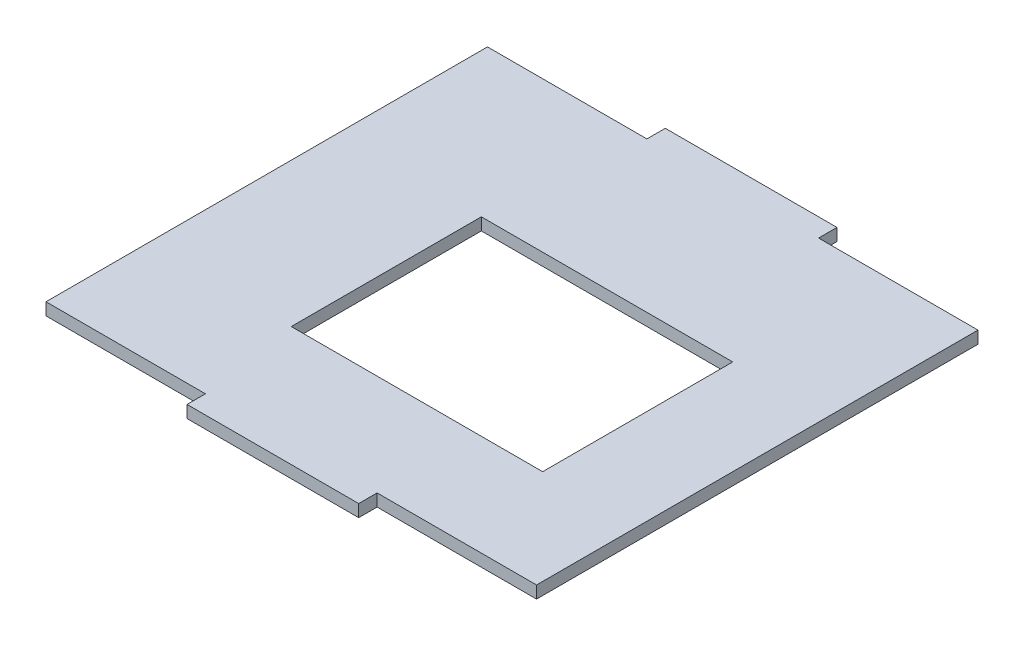
from build123d import *

# Parameters (mm, degrees)
SKETCH_1_W         = 43
SKETCH_1_H         = 39
TOP_DEPTH          = 1
DHT22_WINDOW_REACH = 31.043
SKETCH_2_W         = 20.5
SKETCH_2_H         = 15.5
EAR_REACH          = 31.043


with BuildPart() as part:
    # 스케치1 → Top (new body)
    with BuildSketch(Plane(origin=(0, 0, 0), x_dir=(1, 0, 0), z_dir=(0, 1, 0))):
        Rectangle(SKETCH_1_W, SKETCH_1_H)
    extrude(amount=TOP_DEPTH)

    # 스케치2 → DHT22_window (cut, up to next)
    with BuildSketch(Plane(origin=(0, 1, 0), x_dir=(1, 0, 0), z_dir=(0, 1, 0)), mode=Mode.PRIVATE) as dht22_window_sk1:
        with Locations((2, -2)):
            Rectangle(SKETCH_2_W, SKETCH_2_H)
    dht22_window_tool1 = extrude(dht22_window_sk1.sketch, amount=-DHT22_WINDOW_REACH, mode=Mode.PRIVATE) & part.part
    add(dht22_window_tool1.solids().sort_by_distance((2, 1, 2))[0], mode=Mode.SUBTRACT)

    # 스케치3 → Ear (cut, up to next)
    with BuildSketch(Plane.XZ, mode=Mode.PRIVATE) as ear_sk1:
        Polygon((-20, -18), (-20, 18), (-7, 18), (-7, 19.5), (-21.5, 19.5), (-21.5, -19.5), (-7, -19.5), (-7, -18), align=None)
    ear_tool1 = extrude(ear_sk1.sketch, amount=-EAR_REACH, mode=Mode.PRIVATE) & part.part
    # 스케치3 → Ear (cut, up to next)
    with BuildSketch(Plane.XZ, mode=Mode.PRIVATE) as ear_sk2:
        Polygon((7, 19.5), (7, 18), (20, 18), (20, -18), (7, -18), (7, -19.5), (21.5, -19.5), (21.5, 19.5), align=None)
    ear_tool2 = extrude(ear_sk2.sketch, amount=-EAR_REACH, mode=Mode.PRIVATE) & part.part
    add(ear_tool1.solids().sort_by_distance((-7.416083, 0, -18.75))[0], mode=Mode.SUBTRACT)
    add(ear_tool2.solids().sort_by_distance((7.416083, 0, 18.75))[0], mode=Mode.SUBTRACT)


solid = part.part
